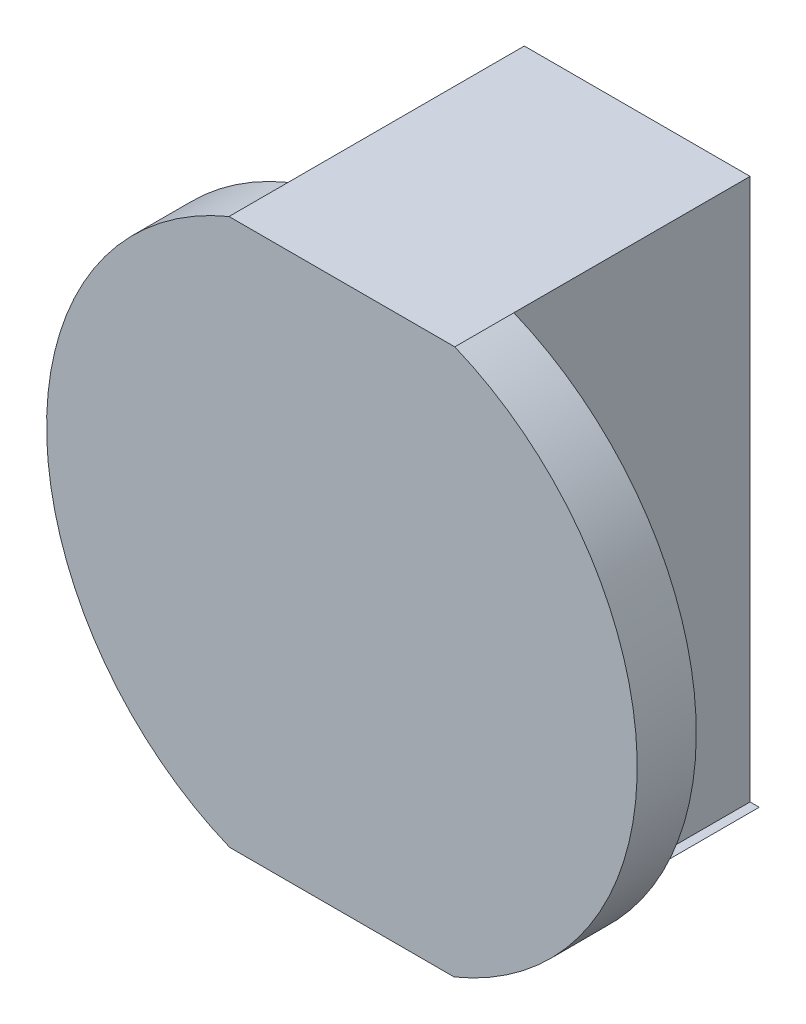
from build123d import *

# Parameters (mm, degrees)
SKETCH_1_R               = 50
EXTRUDE_1_DEPTH          = 57.7
SKETCH_2_W               = 88.552643685
SKETCH_2_H               = 15.944116671
SKETCH_2_W_2             = 133.424200465
SKETCH_2_H_2             = 21.693790907
CUT_EXTRUDE_1_DEPTH      = 57.7
SKETCH_3_W               = 51.791054301
SKETCH_3_H               = 91.732420586
SKETCH_3_W_2             = 35.451128289
SKETCH_3_H_2             = 96.304213357
CUT_EXTRUDE_2_DEPTH      = 40
CUT_EXTRUDE_3_DEPTH      = 35
CUT_EXTRUDE_3_DEPTH_BACK = 77
SKETCH_5_W               = 7.7
SKETCH_5_H               = 94.441631117


with BuildPart() as part:
    # 草图1 → 凸台-拉伸1 (new body)
    with BuildSketch(Plane.XY):
        Circle(SKETCH_1_R)
    extrude(amount=EXTRUDE_1_DEPTH)

    # 草图2 → 切除-拉伸1 (cut)
    with BuildSketch(Plane.XY.offset(57.7)):
        with Locations((0.613398072, 54.174358248)):
            Rectangle(SKETCH_2_W, SKETCH_2_H)
        with Locations((13.337614445, -57.096895454)):
            Rectangle(SKETCH_2_W_2, SKETCH_2_H_2)
    extrude(amount=-CUT_EXTRUDE_1_DEPTH, mode=Mode.SUBTRACT)

    # 草图3 → 切除-拉伸2 (cut)
    with BuildSketch(Plane(origin=(0, 0, 0), x_dir=(-1, 0, 0), z_dir=(0, 0, -1))):
        with Locations((-45.009592204, 0.336089619)):
            Rectangle(SKETCH_3_W, SKETCH_3_H)
        with Locations((36.839629198, -1.949806767)):
            Rectangle(SKETCH_3_W_2, SKETCH_3_H_2)
    extrude(amount=-CUT_EXTRUDE_2_DEPTH, mode=Mode.SUBTRACT)

    # 草图5 → 切除-拉伸3 (cut, two sides: drawn at the far end of the back side and taken through both)
    with BuildSketch(Plane.ZY.offset(19.114065053).offset(-CUT_EXTRUDE_3_DEPTH_BACK)):
        with Locations((53.85, -1.018515647)):
            Rectangle(SKETCH_5_W, SKETCH_5_H)
    extrude(amount=CUT_EXTRUDE_3_DEPTH + CUT_EXTRUDE_3_DEPTH_BACK, mode=Mode.SUBTRACT)


solid = part.part
